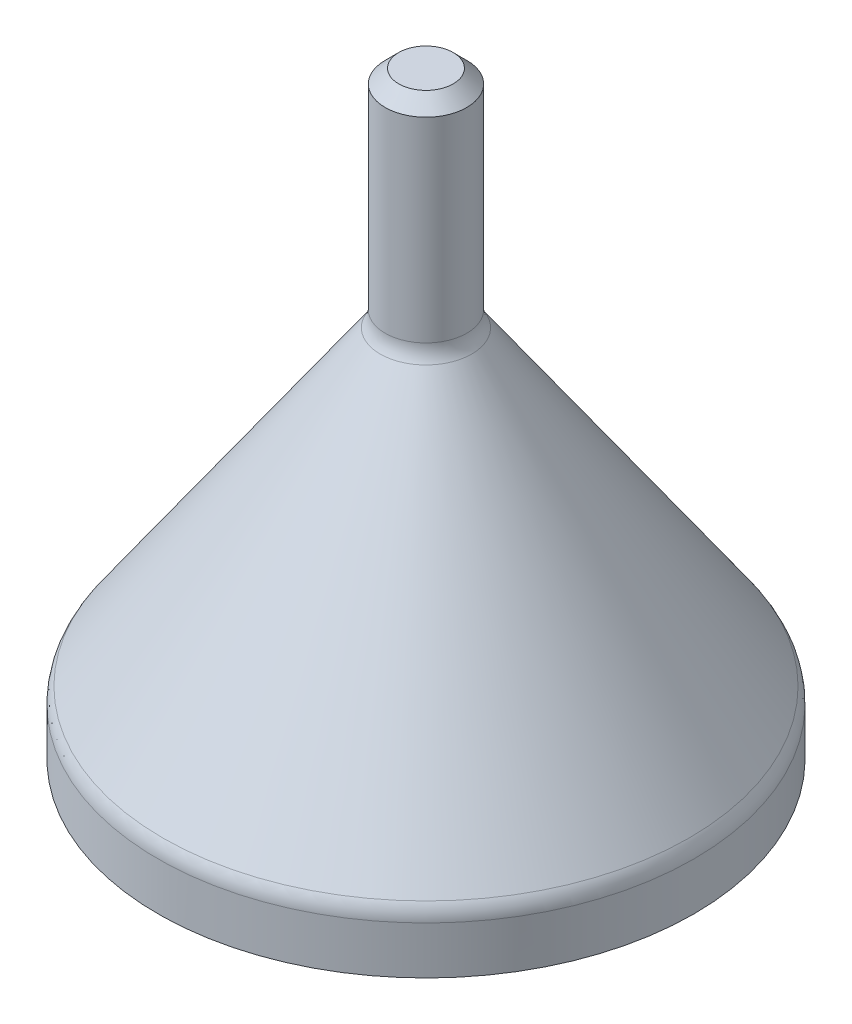
from build123d import *

# Parameters (mm, degrees)
FILLET1_R                       = 2
BOSS_EXTRUDE1_REACH             = 54.062
SKETCH2_R                       = 1.5
BOSS_EXTRUDE1_DIRECTION_2_REACH = 54.062
CHAMFER1_SIZE                   = 1
CUT_EXTRUDE1_START              = -3
CUT_EXTRUDE1_DEPTH              = 3


with BuildPart() as part:
    # Sketch1 → Revolve1 (revolve)
    with BuildSketch(Plane.XY):
        Polygon((17.7, 0), (17.7, 3.5), (0, 28.778219719), (0, 43.98066929), (3, 43.98066929), (3, 27.98066929), (19.7, 4.130597578), (19.7, 0), align=None)
    revolve(axis=Axis((0, 0, 0), (0, 1, 0)))

    # Fillet1
    fillet1_edges = [part.edges().sort_by_distance(p)[0] for p in [
        (-3, 27.98066929, 0),
        (-19.7, 4.130597578, 0),
    ]]
    fillet(fillet1_edges, radius=FILLET1_R)

    # Boss-Extrude1: up to this cone (the profile starts inside it)
    boss_extrude1_end = Plane(origin=(0, 12, 0), z_dir=(0, -1, 0)).offset(-16.778218719) * Cone(1e-06, 58.179162981, 83.088454645, align=(Align.CENTER, Align.CENTER, Align.MIN), mode=Mode.PRIVATE)
    # Sketch2 → Boss-Extrude1 (add, up to the surface)
    with BuildSketch(Plane(origin=(0, 0, 0), x_dir=(0, 0, -1), z_dir=(1, 0, 0)), mode=Mode.PRIVATE) as boss_extrude1_sk1:
        with Locations(Location((0, 12, 0), (0, 0, 356.704943747))):
            Circle(SKETCH2_R)
    boss_extrude1_tool1 = extrude(boss_extrude1_sk1.sketch, amount=BOSS_EXTRUDE1_REACH, mode=Mode.PRIVATE) & boss_extrude1_end
    add(boss_extrude1_tool1.solids().sort_by_distance((0, 12, 0))[0])

    # Boss-Extrude1 direction 2: up to this cone (the profile starts inside it)
    boss_extrude1_direction_2_end = Plane(origin=(0, 12, 0), z_dir=(0, -1, 0)).offset(-16.778218719) * Cone(1e-06, 58.179162981, 83.088454645, align=(Align.CENTER, Align.CENTER, Align.MIN), mode=Mode.PRIVATE)
    # Sketch2 → Boss-Extrude1 direction 2 (add, up to the surface)
    with BuildSketch(Plane(origin=(0, 0, 0), x_dir=(0, 0, -1), z_dir=(1, 0, 0)), mode=Mode.PRIVATE) as boss_extrude1_direction_2_sk1:
        with Locations(Location((0, 12, 0), (0, 0, 356.704943747))):
            Circle(SKETCH2_R)
    boss_extrude1_direction_2_tool1 = extrude(boss_extrude1_direction_2_sk1.sketch, amount=-BOSS_EXTRUDE1_DIRECTION_2_REACH, mode=Mode.PRIVATE) & boss_extrude1_direction_2_end
    add(boss_extrude1_direction_2_tool1.solids().sort_by_distance((0, 12, 0))[0])

    # Chamfer1
    chamfer1_edges = [part.edges().sort_by_distance(p)[0] for p in [
        (-3, 43.98066929, 0),
    ]]
    chamfer(chamfer1_edges, length=CHAMFER1_SIZE)

    # Sketch3 → Cut-Extrude1 (cut)
    with BuildSketch(Plane.XZ.offset(CUT_EXTRUDE1_START)):
        with BuildLine():
            Line((-3.2, 18.627130751), (-3.2, 17.408331339))
            ThreePointArc((-3.2, 17.408331339), (0, 17.7), (3.2, 17.408331339))
            Line((3.2, 17.408331339), (3.2, 18.627130751))
            ThreePointArc((3.2, 18.627130751), (0, 18.9), (-3.2, 18.627130751))
        make_face()
        with BuildLine():
            Line((3.2, -17.408331339), (3.2, -18.627130751))
            ThreePointArc((3.2, -18.627130751), (0, -18.9), (-3.2, -18.627130751))
            Line((-3.2, -18.627130751), (-3.2, -17.408331339))
            ThreePointArc((-3.2, -17.408331339), (0, -17.7), (3.2, -17.408331339))
        make_face()
    extrude(amount=CUT_EXTRUDE1_DEPTH, mode=Mode.SUBTRACT)


solid = part.part
